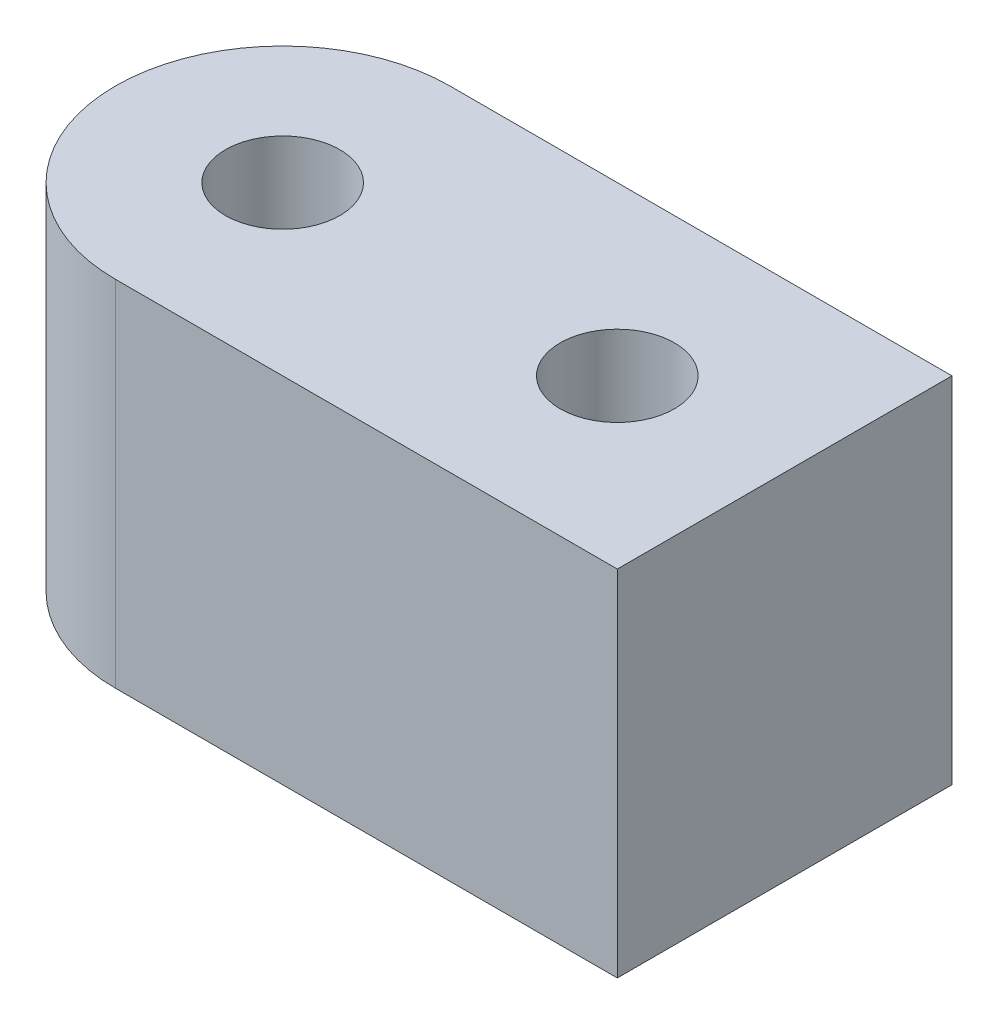
from build123d import *

# Parameters (mm, degrees)
SKETCH1_R           = 2.05
BOSS_EXTRUDE1_DEPTH = 12.7


with BuildPart() as part:
    # Sketch1 → Boss-Extrude1 (new body)
    with BuildSketch(Plane(origin=(0, 0, 0), x_dir=(1, 0, 0), z_dir=(0, 1, 0))):
        with BuildLine():
            Line((6, 6), (6, -6))
            Line((6, -6), (-12, -6))
            ThreePointArc((-12, -6), (-18, 0), (-12, 6))
            Line((-12, 6), (6, 6))
        make_face()
        with Locations(Location((0, 0, 0), (0, 0, 270))):
            Circle(SKETCH1_R, mode=Mode.SUBTRACT)
        with Locations(Location((-12, 0, 0), (0, 0, 270))):
            Circle(SKETCH1_R, mode=Mode.SUBTRACT)
    extrude(amount=BOSS_EXTRUDE1_DEPTH)


solid = part.part
